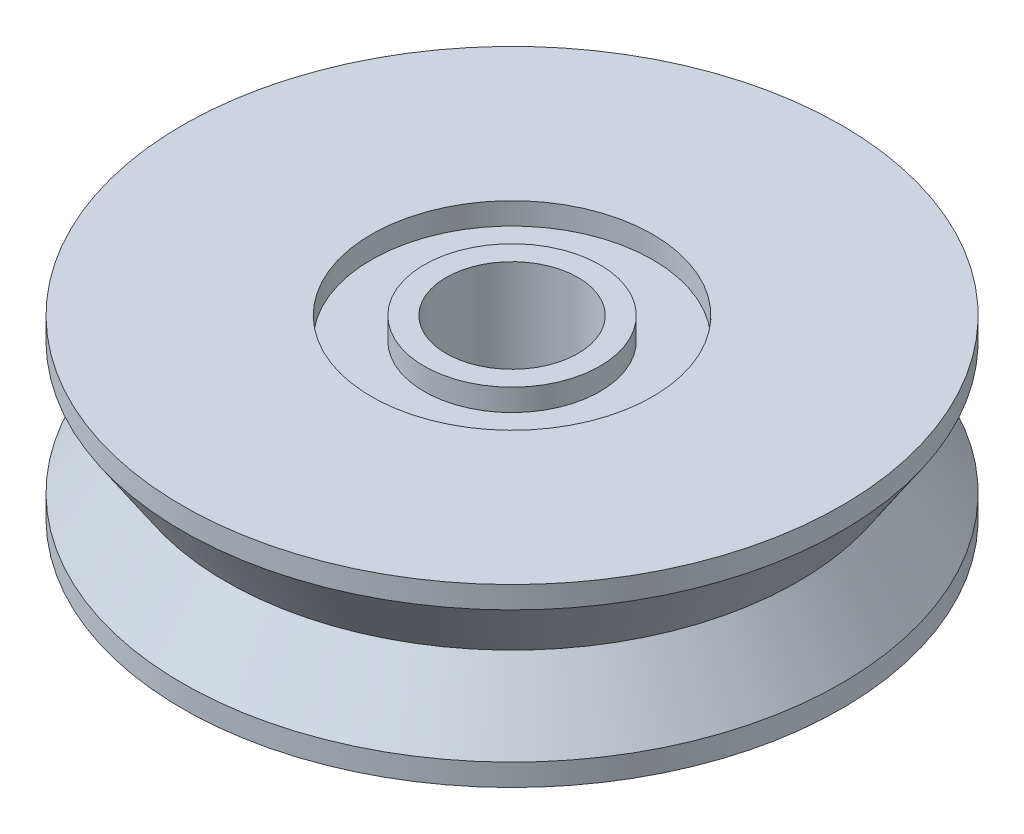
from build123d import *


with BuildPart() as part:
    # Sketch1 → Revolve1 (revolve)
    with BuildSketch(Plane.XY, mode=Mode.PRIVATE) as revolve1_sk:
        Polygon((-1.5, 0), (-1.5, 2), (-2, 2), (-2, 1.5), (-3.2, 1.5), (-3.2, 2), (-7.5, 2), (-7.5, 1.5), (-6.5, 0), align=None)
    revolve1 = revolve(revolve1_sk.sketch.rotate(Axis((0, 0, 0), (0, 1, 0)), 270), axis=Axis((0, 0, 0), (0, 1, 0)))

    # Mirror1: Revolve1 across plane
    add(revolve1.mirror(Plane(origin=(-6.5, 0, 0), x_dir=(0, 0, 1), z_dir=(0, 1, 0))))


solid = part.part
